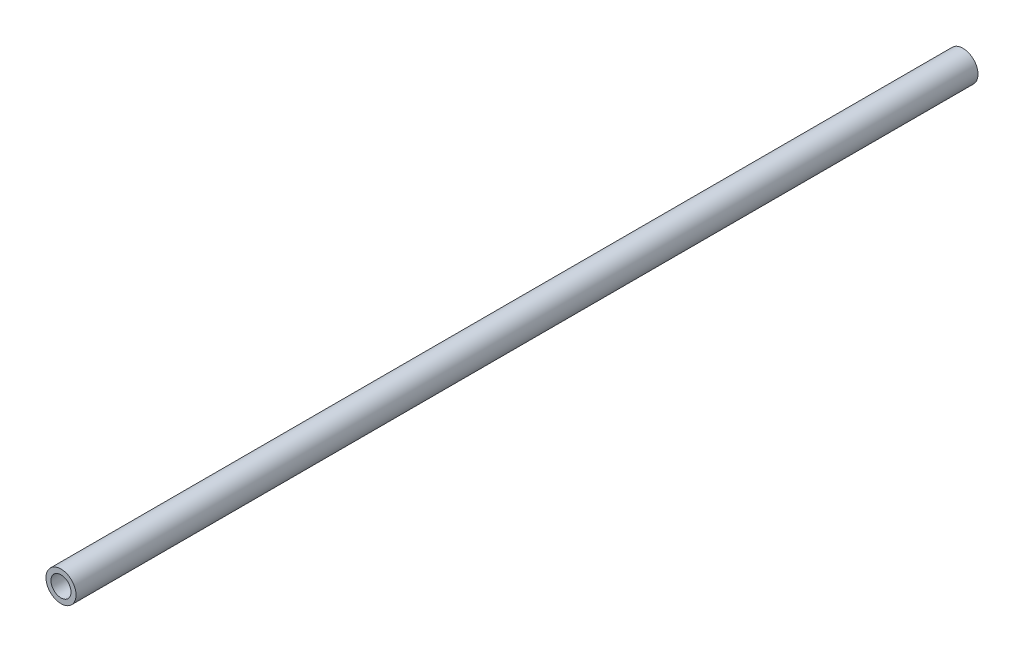
from build123d import *

# Parameters (mm, degrees)
SKETCH1_R           = 7.5
SKETCH1_R_2         = 5
BOSS_EXTRUDE1_DEPTH = 450


with BuildPart() as part:
    # Sketch1 → Boss-Extrude1 (new body)
    with BuildSketch(Plane.XY):
        with Locations((390.7614039, 31.081528881)):
            Circle(SKETCH1_R)
        with Locations((390.7614039, 31.081528881)):
            Circle(SKETCH1_R_2, mode=Mode.SUBTRACT)
    extrude(amount=BOSS_EXTRUDE1_DEPTH)


solid = part.part
